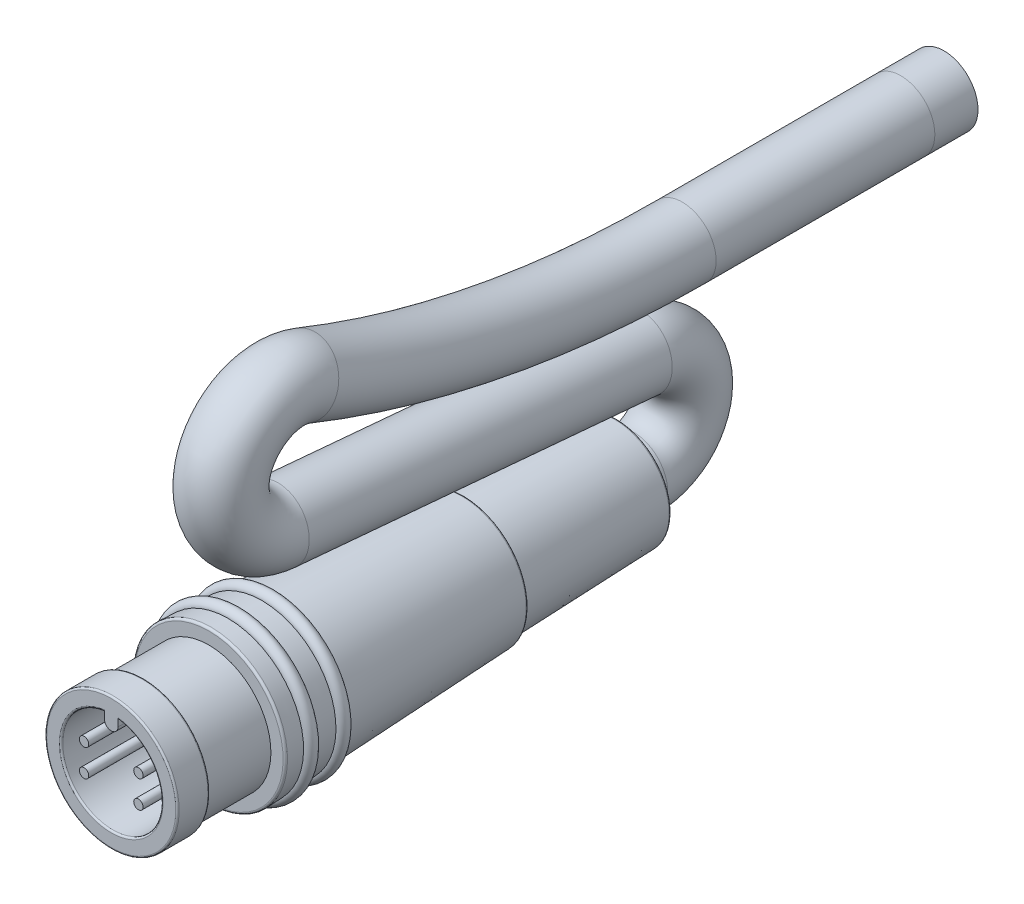
from build123d import *

# Parameters (mm, degrees)
BOSS_EXTRUDE1_REACH = 26.943
SKETCH2_R           = 0.275
SWEEP4_PROFILE_R    = 2


with BuildPart() as part:
    # Sketch1 → Revolve1 (revolve)
    with BuildSketch(Plane(origin=(0, 0, 0), x_dir=(0, 0, -1), z_dir=(1, 0, 0))):
        with BuildLine():
            Line((0, 2.95), (0, 0))
            Line((0, 0), (24, 0))
            Line((24, 0), (24, 3.090501275))
            ThreePointArc((24, 3.090501275), (23.964371882, 3.178706599), (23.877477492, 3.217422322))
            Line((23.877477492, 3.217422322), (15.122522508, 3.526277678))
            ThreePointArc((15.122522508, 3.526277678), (15.035628118, 3.564993401), (15, 3.653198725))
            Line((15, 3.653198725), (15, 3.676110245))
            ThreePointArc((15, 3.676110245), (14.96487971, 3.763786462), (14.878943009, 3.802971117))
            Line((14.878943009, 3.802971117), (3.874589187, 4.318488412))
            ThreePointArc((3.874589187, 4.318488412), (3.517548255, 4.710625853), (3.125410813, 4.353584921))
            Line((3.125410813, 4.353584921), (1.874589187, 4.412181745))
            ThreePointArc((1.874589187, 4.412181745), (1.517548255, 4.804319187), (1.125410813, 4.447278255))
            Line((1.125410813, 4.447278255), (0.132943009, 4.493772063))
            ThreePointArc((0.132943009, 4.493772063), (0.039323784, 4.458790902), (0, 4.366911192))
            Line((0, 4.366911192), (0, 3.65))
            Line((0, 3.65), (-3.75, 3.65))
            ThreePointArc((-3.75, 3.65), (-3.820710678, 3.679289322), (-3.85, 3.75))
            Line((-3.85, 3.75), (-3.85, 3.8))
            ThreePointArc((-3.85, 3.8), (-3.879289322, 3.870710678), (-3.95, 3.9))
            Line((-3.95, 3.9), (-5.65, 3.9))
            ThreePointArc((-5.65, 3.9), (-5.720710678, 3.870710678), (-5.75, 3.8))
            Line((-5.75, 3.8), (-5.75, 3.05))
            ThreePointArc((-5.75, 3.05), (-5.720710678, 2.979289322), (-5.65, 2.95))
            Line((-5.65, 2.95), (0, 2.95))
        make_face()
    revolve(axis=Axis((0, 0, -24), (0, 0, 1)))

    # Boss-Extrude1: up to this face of the body (flat: up to its plane)
    boss_extrude1_end = Plane(part.part.faces().sort_by_distance((0, -3.692519769, 5.75))[0])
    # Sketch2 → Boss-Extrude1 (add, up to the picked face)
    with BuildSketch(Plane.XY, mode=Mode.PRIVATE) as boss_extrude1_sk1:
        with Locations(Location((-1.599999975, 0.8, 0), (0, 0, 90))):
            Circle(SKETCH2_R)
    boss_extrude1_tool1 = split(extrude(boss_extrude1_sk1.sketch, amount=BOSS_EXTRUDE1_REACH, mode=Mode.PRIVATE), bisect_by=boss_extrude1_end, keep=Keep.BOTH, mode=Mode.PRIVATE)
    # Sketch2 → Boss-Extrude1 (add, up to the picked face)
    with BuildSketch(Plane.XY, mode=Mode.PRIVATE) as boss_extrude1_sk2:
        with Locations(Location((-1.599999975, -0.8, 0), (0, 0, 90))):
            Circle(SKETCH2_R)
    boss_extrude1_tool2 = split(extrude(boss_extrude1_sk2.sketch, amount=BOSS_EXTRUDE1_REACH, mode=Mode.PRIVATE), bisect_by=boss_extrude1_end, keep=Keep.BOTH, mode=Mode.PRIVATE)
    # Sketch2 → Boss-Extrude1 (add, up to the picked face)
    with BuildSketch(Plane.XY, mode=Mode.PRIVATE) as boss_extrude1_sk3:
        with Locations(Location((1.599999975, -0.8, 0), (0, 0, 90))):
            Circle(SKETCH2_R)
    boss_extrude1_tool3 = split(extrude(boss_extrude1_sk3.sketch, amount=BOSS_EXTRUDE1_REACH, mode=Mode.PRIVATE), bisect_by=boss_extrude1_end, keep=Keep.BOTH, mode=Mode.PRIVATE)
    # Sketch2 → Boss-Extrude1 (add, up to the picked face)
    with BuildSketch(Plane.XY, mode=Mode.PRIVATE) as boss_extrude1_sk4:
        with Locations(Location((1.599999975, 0.8, 0), (0, 0, 90))):
            Circle(SKETCH2_R)
    boss_extrude1_tool4 = split(extrude(boss_extrude1_sk4.sketch, amount=BOSS_EXTRUDE1_REACH, mode=Mode.PRIVATE), bisect_by=boss_extrude1_end, keep=Keep.BOTH, mode=Mode.PRIVATE)
    # Sketch2 → Boss-Extrude1 (add, up to the picked face)
    with BuildSketch(Plane.XY, mode=Mode.PRIVATE) as boss_extrude1_sk5:
        with BuildLine():
            Line((0.4, 2.95), (0.4, 2.55))
            ThreePointArc((0.4, 2.55), (0, 2.15), (-0.4, 2.55))
            Line((-0.4, 2.55), (-0.4, 2.95))
            ThreePointArc((-0.4, 2.95), (0, 3.35), (0.4, 2.95))
        make_face()
    boss_extrude1_tool5 = split(extrude(boss_extrude1_sk5.sketch, amount=BOSS_EXTRUDE1_REACH, mode=Mode.PRIVATE), bisect_by=boss_extrude1_end, keep=Keep.BOTH, mode=Mode.PRIVATE)
    add(boss_extrude1_tool1.solids().sort_by(Axis((-1.6, 0.8, 0), (0, 0, 1)))[0])
    add(boss_extrude1_tool2.solids().sort_by(Axis((-1.6, -0.8, 0), (0, 0, 1)))[0])
    add(boss_extrude1_tool3.solids().sort_by(Axis((1.6, -0.8, 0), (0, 0, 1)))[0])
    add(boss_extrude1_tool4.solids().sort_by(Axis((1.6, 0.8, 0), (0, 0, 1)))[0])
    add(boss_extrude1_tool5.solids().sort_by(Axis((0, 2.75, 0), (0, 0, 1)))[0])

    # Sweep4: sweep along a path in Sketch3
    with BuildLine(Plane(origin=(0, 0, 0), x_dir=(0, 0, -1), z_dir=(1, 0, 0))) as sweep4_path:
        Line((43.272, 10.306619036), (40.732, 10.306619036))
        Line((40.732, 10.306619036), (27.858069254, 10.306619036))
        ThreePointArc((27.858069254, 10.306619036), (16.478126973, 11.395695485), (5.511305597, 14.62338858))
        ThreePointArc((5.511305597, 14.62338858), (0.804092104, 12.190768136), (3.897633165, 7.88896563))
        Line((3.897633165, 7.88896563), (25.265809615, 5.988201005))
        ThreePointArc((25.265809615, 5.988201005), (27.9970488, 2.866964321), (25, 0))
        Line((25, 0), (24, 0))
    # Sweep4 profile (on start of the path) → Sweep4 (sweep)
    with BuildSketch(Plane(origin=(0, 10.306619036, -43.272), x_dir=(0, 1, 0), z_dir=(0, 0, 1))):
        Circle(SWEEP4_PROFILE_R)
    sweep(path=sweep4_path.line)


solid = part.part
